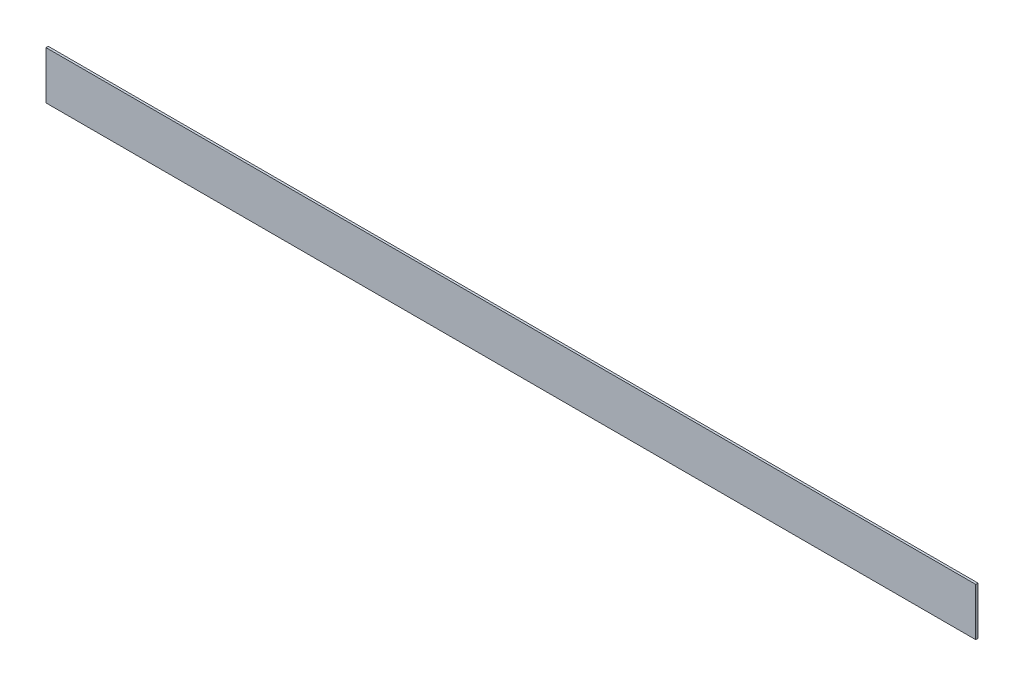
from build123d import *

# Parameters (mm, degrees)
SKETCH_1_W      = 2056
SKETCH_1_H      = 106
EXTRUDE_1_DEPTH = 5


with BuildPart() as part:
    # 草图1 → 凸台-拉伸1 (new body)
    with BuildSketch(Plane.XY):
        with Locations((1028, 53)):
            Rectangle(SKETCH_1_W, SKETCH_1_H)
    extrude(amount=EXTRUDE_1_DEPTH)


solid = part.part
